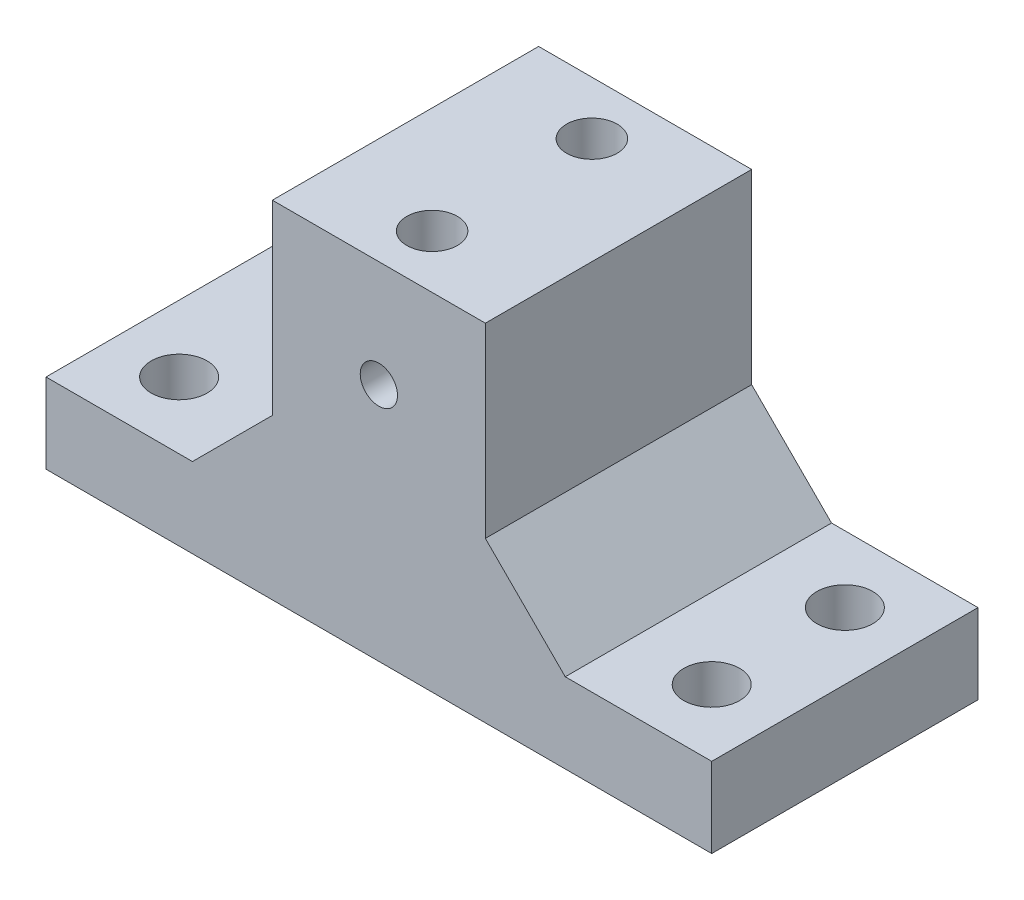
from build123d import *

# Parameters (mm, degrees)
SKETCH1_W           = 25
SKETCH1_H           = 10
SKETCH1_R           = 1.05
BOSS_EXTRUDE1_DEPTH = 3
SKETCH3_W           = 8
SKETCH3_H           = 13
BOSS_EXTRUDE2_DEPTH = 10
SKETCH4_R           = 0.7
CUT_EXTRUDE1_DEPTH  = 21.621590627
SKETCH5_R           = 0.95
CUT_EXTRUDE2_DEPTH  = 3.5
CHAMFER1_SIZE       = 3


with BuildPart() as part:
    # Sketch1 → Boss-Extrude1 (new body)
    with BuildSketch(Plane(origin=(0, 0, 0), x_dir=(1, 0, 0), z_dir=(0, 1, 0))):
        Rectangle(SKETCH1_W, SKETCH1_H)
        with Locations(Location((-10, 2.5, 0), (0, 0, 270))):
            Circle(SKETCH1_R, mode=Mode.SUBTRACT)
        with Locations(Location((-10, -2.5, 0), (0, 0, 270))):
            Circle(SKETCH1_R, mode=Mode.SUBTRACT)
        with Locations(Location((10, 2.5, 0), (0, 0, 270))):
            Circle(SKETCH1_R, mode=Mode.SUBTRACT)
        with Locations(Location((10, -2.5, 0), (0, 0, 270))):
            Circle(SKETCH1_R, mode=Mode.SUBTRACT)
    extrude(amount=BOSS_EXTRUDE1_DEPTH)

    # Sketch3 → Boss-Extrude2 (add)
    with BuildSketch(Plane(origin=(0, 0, -5), x_dir=(-1, 0, 0), z_dir=(0, 0, -1))):
        with Locations((0, 6.5)):
            Rectangle(SKETCH3_W, SKETCH3_H)
    extrude(amount=-BOSS_EXTRUDE2_DEPTH)

    # Sketch4 → Cut-Extrude1 (cut, through all)
    with BuildSketch(Plane(origin=(0, 0, -5), x_dir=(-1, 0, 0), z_dir=(0, 0, -1))):
        with Locations((0, 9)):
            Circle(SKETCH4_R)
    extrude(amount=-CUT_EXTRUDE1_DEPTH, mode=Mode.SUBTRACT)

    # Sketch5 → Cut-Extrude2 (cut)
    with BuildSketch(Plane(origin=(0, 13, 0), x_dir=(1, 0, 0), z_dir=(0, 1, 0))):
        with Locations(Location((0, 3, 0), (0, 0, 180))):
            Circle(SKETCH5_R)
        with Locations(Location((0, -3, 0), (0, 0, 180))):
            Circle(SKETCH5_R)
    extrude(amount=-CUT_EXTRUDE2_DEPTH, mode=Mode.SUBTRACT)

    # Chamfer1
    chamfer1_edges = [part.edges().sort_by_distance(p)[0] for p in [
        (4, 3, 0),
        (-4, 3, 0),
    ]]
    chamfer(chamfer1_edges, length=CHAMFER1_SIZE)


solid = part.part
